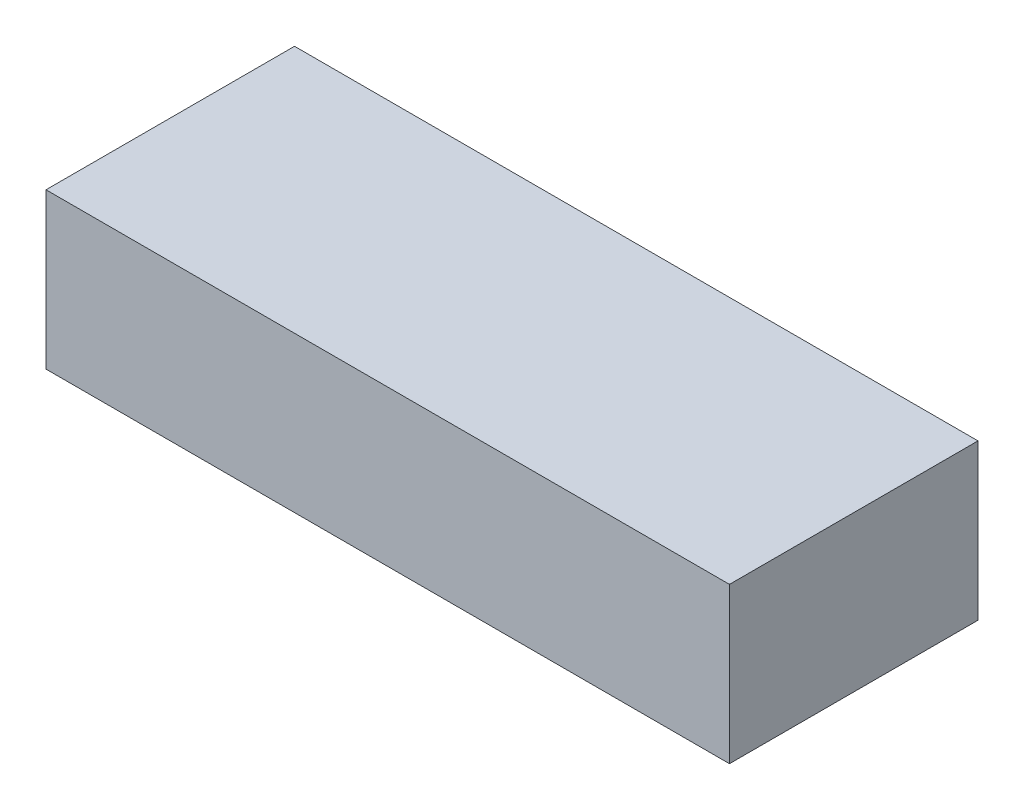
from build123d import *

# Parameters (mm, degrees)
SKETCH1_W           = 69.85
SKETCH1_H           = 15.875
BOSS_EXTRUDE1_DEPTH = 25.4


with BuildPart() as part:
    # Sketch1 → Boss-Extrude1 (new body)
    with BuildSketch(Plane.XY):
        Rectangle(SKETCH1_W, SKETCH1_H)
    extrude(amount=BOSS_EXTRUDE1_DEPTH)


solid = part.part
